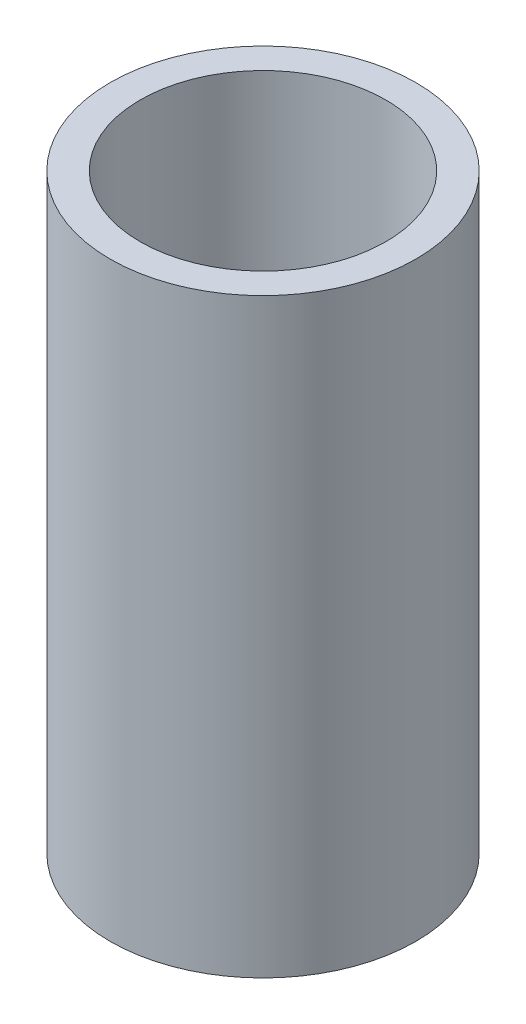
from build123d import *

# Parameters (mm, degrees)
SKETCH2_R           = 12.935
SKETCH2_R_2         = 10.395
BOSS_EXTRUDE1_DEPTH = 50


with BuildPart() as part:
    # Sketch2 → Boss-Extrude1 (new body)
    with BuildSketch(Plane(origin=(0, 0, 0), x_dir=(1, 0, 0), z_dir=(0, 1, 0))):
        with Locations(Location((0, 0, 0), (0, 0, 270))):
            Circle(SKETCH2_R)
        with Locations(Location((0, 0, 0), (0, 0, 270))):
            Circle(SKETCH2_R_2, mode=Mode.SUBTRACT)
    extrude(amount=BOSS_EXTRUDE1_DEPTH)


solid = part.part
